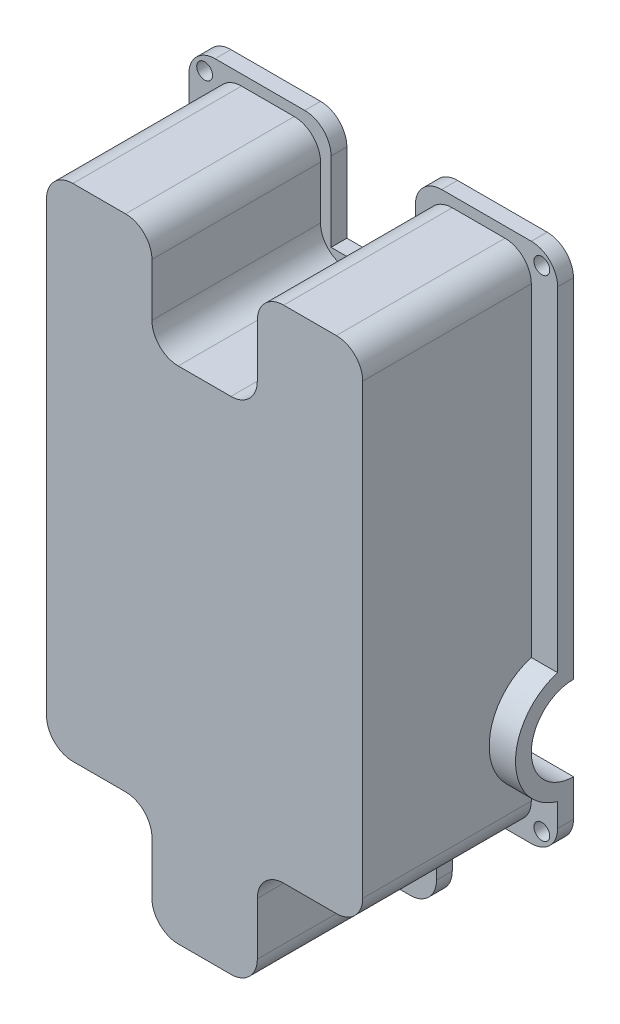
from build123d import *

# Parameters (mm, degrees)
SKETCH1_W           = 70
SKETCH1_H           = 119
BOSS_EXTRUDE1_DEPTH = 35
SKETCH2_R           = 8
CUT_EXTRUDE1_DEPTH  = 8
SKETCH3_R           = 8
CUT_EXTRUDE2_DEPTH  = 8
SKETCH4_W           = 14
SKETCH4_H           = 89
CUT_EXTRUDE3_DEPTH  = 32
CUT_EXTRUDE4_REACH  = 82.804
CUT_EXTRUDE5_REACH  = 82.804
SKETCH7_W           = 23
SKETCH7_H           = 20
SKETCH7_W_2         = 16
CUT_EXTRUDE6_DEPTH  = 78.396705356
CUT_EXTRUDE7_DEPTH  = 5
SKETCH9_W           = 18
SKETCH9_H           = 32
CUT_EXTRUDE8_DEPTH  = 2
SKETCH10_W          = 24
SKETCH10_H          = 32
CUT_EXTRUDE9_DEPTH  = 2
SKETCH11_W          = 23
SKETCH11_H          = 32
CUT_EXTRUDE10_DEPTH = 2
SKETCH12_W          = 32
SKETCH12_H          = 20
CUT_EXTRUDE11_DEPTH = 2
SKETCH13_W          = 32
SKETCH13_H          = 20
CUT_EXTRUDE12_DEPTH = 2
SKETCH14_W          = 65
SKETCH14_H          = 32
CUT_EXTRUDE13_DEPTH = 2
SKETCH15_W          = 16
SKETCH15_H          = 32
CUT_EXTRUDE15_DEPTH = 2
SKETCH17_W          = 32
SKETCH17_H          = 20
CUT_EXTRUDE16_DEPTH = 2
SKETCH18_W          = 32
SKETCH18_H          = 20
CUT_EXTRUDE17_DEPTH = 2
SKETCH20_W          = 32
SKETCH20_H          = 95
CUT_EXTRUDE18_DEPTH = 5
SKETCH21_R          = 1.5
CUT_EXTRUDE20_DEPTH = 10
FILLET1_R           = 5
FILLET2_R           = 5


with BuildPart() as part:
    # Sketch1 → Boss-Extrude1 (new body)
    with BuildSketch(Plane.XY):
        Rectangle(SKETCH1_W, SKETCH1_H)
    extrude(amount=BOSS_EXTRUDE1_DEPTH)

    # Sketch2 → Cut-Extrude1 (cut)
    with BuildSketch(Plane(origin=(35, 0, 0), x_dir=(0, 0, -1), z_dir=(1, 0, 0))):
        with Locations((0, -19.5)):
            Circle(SKETCH2_R)
    extrude(amount=-CUT_EXTRUDE1_DEPTH, mode=Mode.SUBTRACT)

    # Sketch3 → Cut-Extrude2 (cut)
    with BuildSketch(Plane.ZY.offset(35)):
        with Locations((0, 19.5)):
            Circle(SKETCH3_R)
    extrude(amount=-CUT_EXTRUDE2_DEPTH, mode=Mode.SUBTRACT)

    # Sketch4 → Cut-Extrude3 (cut)
    with BuildSketch(Plane(origin=(0, 0, 0), x_dir=(-1, 0, 0), z_dir=(0, 0, -1))):
        with Locations((-20, 9.526034086)):
            Rectangle(SKETCH4_W, SKETCH4_H)
        with Locations((0, -10)):
            Rectangle(SKETCH4_W, SKETCH4_H)
        with Locations((20, 9.526034086)):
            Rectangle(SKETCH4_W, SKETCH4_H)
    extrude(amount=-CUT_EXTRUDE3_DEPTH, mode=Mode.SUBTRACT)

    # Sketch5 → Cut-Extrude4 (cut, up to next)
    with BuildSketch(Plane.ZY.offset(-7), mode=Mode.PRIVATE) as cut_extrude4_sk1:
        with BuildLine():
            Line((0, 27.5), (0, 11.5))
            ThreePointArc((0, 11.5), (8, 19.5), (0, 27.5))
        make_face()
    cut_extrude4_tool1 = extrude(cut_extrude4_sk1.sketch, amount=-CUT_EXTRUDE4_REACH, mode=Mode.PRIVATE) & part.part
    add(cut_extrude4_tool1.solids().sort_by_distance((7, 19.5, 3.395305))[0], mode=Mode.SUBTRACT)

    # Sketch6 → Cut-Extrude5 (cut, up to next)
    with BuildSketch(Plane(origin=(-7, 0, 0), x_dir=(0, 0, -1), z_dir=(1, 0, 0)), mode=Mode.PRIVATE) as cut_extrude5_sk1:
        with BuildLine():
            Line((0, -27.5), (0, -11.5))
            ThreePointArc((0, -11.5), (-8, -19.5), (0, -27.5))
        make_face()
    cut_extrude5_tool1 = extrude(cut_extrude5_sk1.sketch, amount=-CUT_EXTRUDE5_REACH, mode=Mode.PRIVATE) & part.part
    add(cut_extrude5_tool1.solids().sort_by_distance((-7, -19.5, 3.395305))[0], mode=Mode.SUBTRACT)

    # Sketch7 → Cut-Extrude6 (cut, through all)
    with BuildSketch(Plane(origin=(0, 0, 0), x_dir=(-1, 0, 0), z_dir=(0, 0, -1))):
        with Locations((23.5, -49.5)):
            Rectangle(SKETCH7_W, SKETCH7_H)
        with Locations((0, 49.5)):
            Rectangle(SKETCH7_W_2, SKETCH7_H)
        with Locations((-23.5, -49.5)):
            Rectangle(SKETCH7_W, SKETCH7_H)
    extrude(amount=-CUT_EXTRUDE6_DEPTH, mode=Mode.SUBTRACT)

    # Sketch8 → Cut-Extrude7 (cut)
    with BuildSketch(Plane(origin=(35, 0, 0), x_dir=(0, 0, -1), z_dir=(1, 0, 0))):
        with BuildLine():
            Line((-3, 59.5), (-35, 59.5))
            Line((-35, 59.5), (-35, -39.5))
            Line((-35, -39.5), (-3, -39.5))
            Line((-3, -39.5), (-3, -30.083005244))
            ThreePointArc((-3, -30.083005244), (-11, -19.5), (-3, -8.916994756))
            Line((-3, -8.916994756), (-3, 59.5))
        make_face()
    extrude(amount=-CUT_EXTRUDE7_DEPTH, mode=Mode.SUBTRACT)

    # Sketch9 → Cut-Extrude8 (cut)
    with BuildSketch(Plane.XZ.offset(39.5)):
        with Locations((21, 19)):
            Rectangle(SKETCH9_W, SKETCH9_H)
    extrude(amount=-CUT_EXTRUDE8_DEPTH, mode=Mode.SUBTRACT)

    # Sketch10 → Cut-Extrude9 (cut)
    with BuildSketch(Plane.XZ.offset(59.5)):
        with Locations((0, 19)):
            Rectangle(SKETCH10_W, SKETCH10_H)
    extrude(amount=-CUT_EXTRUDE9_DEPTH, mode=Mode.SUBTRACT)

    # Sketch11 → Cut-Extrude10 (cut)
    with BuildSketch(Plane.XZ.offset(39.5)):
        with Locations((-23.5, 19)):
            Rectangle(SKETCH11_W, SKETCH11_H)
    extrude(amount=-CUT_EXTRUDE10_DEPTH, mode=Mode.SUBTRACT)

    # Sketch12 → Cut-Extrude11 (cut)
    with BuildSketch(Plane.ZY.offset(12)):
        with Locations((19, -47.5)):
            Rectangle(SKETCH12_W, SKETCH12_H)
    extrude(amount=-CUT_EXTRUDE11_DEPTH, mode=Mode.SUBTRACT)

    # Sketch13 → Cut-Extrude12 (cut)
    with BuildSketch(Plane(origin=(12, 0, 0), x_dir=(0, 0, -1), z_dir=(1, 0, 0))):
        with Locations((-19, -47.5)):
            Rectangle(SKETCH13_W, SKETCH13_H)
    extrude(amount=-CUT_EXTRUDE12_DEPTH, mode=Mode.SUBTRACT)

    # Sketch14 → Cut-Extrude13 (cut)
    with BuildSketch(Plane(origin=(0, 59.5, 0), x_dir=(1, 0, 0), z_dir=(0, 1, 0))):
        with Locations((-2.5, -19)):
            Rectangle(SKETCH14_W, SKETCH14_H)
    extrude(amount=-CUT_EXTRUDE13_DEPTH, mode=Mode.SUBTRACT)

    # Sketch15 → Cut-Extrude15 (cut)
    with BuildSketch(Plane(origin=(0, 39.5, 0), x_dir=(1, 0, 0), z_dir=(0, 1, 0))):
        with Locations((0, -19)):
            Rectangle(SKETCH15_W, SKETCH15_H)
    extrude(amount=-CUT_EXTRUDE15_DEPTH, mode=Mode.SUBTRACT)

    # Sketch17 → Cut-Extrude16 (cut)
    with BuildSketch(Plane(origin=(-8, 0, 0), x_dir=(0, 0, -1), z_dir=(1, 0, 0))):
        with Locations((-19, 47.5)):
            Rectangle(SKETCH17_W, SKETCH17_H)
    extrude(amount=-CUT_EXTRUDE16_DEPTH, mode=Mode.SUBTRACT)

    # Sketch18 → Cut-Extrude17 (cut)
    with BuildSketch(Plane.ZY.offset(-8)):
        with Locations((19, 47.5)):
            Rectangle(SKETCH18_W, SKETCH18_H)
    extrude(amount=-CUT_EXTRUDE17_DEPTH, mode=Mode.SUBTRACT)

    # Sketch20 → Cut-Extrude18 (cut)
    with BuildSketch(Plane.ZY.offset(35)):
        with Locations((19, 10)):
            Rectangle(SKETCH20_W, SKETCH20_H)
    extrude(amount=-CUT_EXTRUDE18_DEPTH, mode=Mode.SUBTRACT)

    # Sketch21 → Cut-Extrude20 (cut)
    with BuildSketch(Plane(origin=(0, 0, 0), x_dir=(-1, 0, 0), z_dir=(0, 0, -1))):
        with Locations((-32, 56.5)):
            Circle(SKETCH21_R)
        with Locations((32, 56.5)):
            Circle(SKETCH21_R)
        with Locations((32, -36.5)):
            Circle(SKETCH21_R)
        with Locations((-32, -36.5)):
            Circle(SKETCH21_R)
    extrude(amount=-CUT_EXTRUDE20_DEPTH, mode=Mode.SUBTRACT)

    # Fillet1
    fillet1_edges = [part.edges().sort_by_distance(p)[0] for p in [
        (30, -37.5, 19),
        (-10, -57.5, 19),
        (-10, -37.5, 19),
        (10, -37.5, 19),
        (10, -57.5, 19),
        (30, 57.5, 19),
        (-10, 37.5, 19),
        (-10, 57.5, 19),
        (10, 57.5, 19),
        (10, 37.5, 19),
        (-30, 57.5, 19),
        (-30, -37.5, 19),
    ]]
    fillet(fillet1_edges, radius=FILLET1_R)

    # Fillet2
    fillet2_edges = [part.edges().sort_by_distance(p)[0] for p in [
        (35, 59.5, 1.5),
        (8, 59.5, 1.5),
        (-8, 59.5, 1.5),
        (-35, 59.5, 1.5),
        (-35, 11.64730658, 1.5281381),
        (-35, 27.35269342, 1.5281381),
        (-35, -39.5, 1.5),
        (-12, -59.5, 1.5),
        (12, -59.5, 1.5),
        (35, -39.5, 1.5),
    ]]
    fillet(fillet2_edges, radius=FILLET2_R)


solid = part.part
